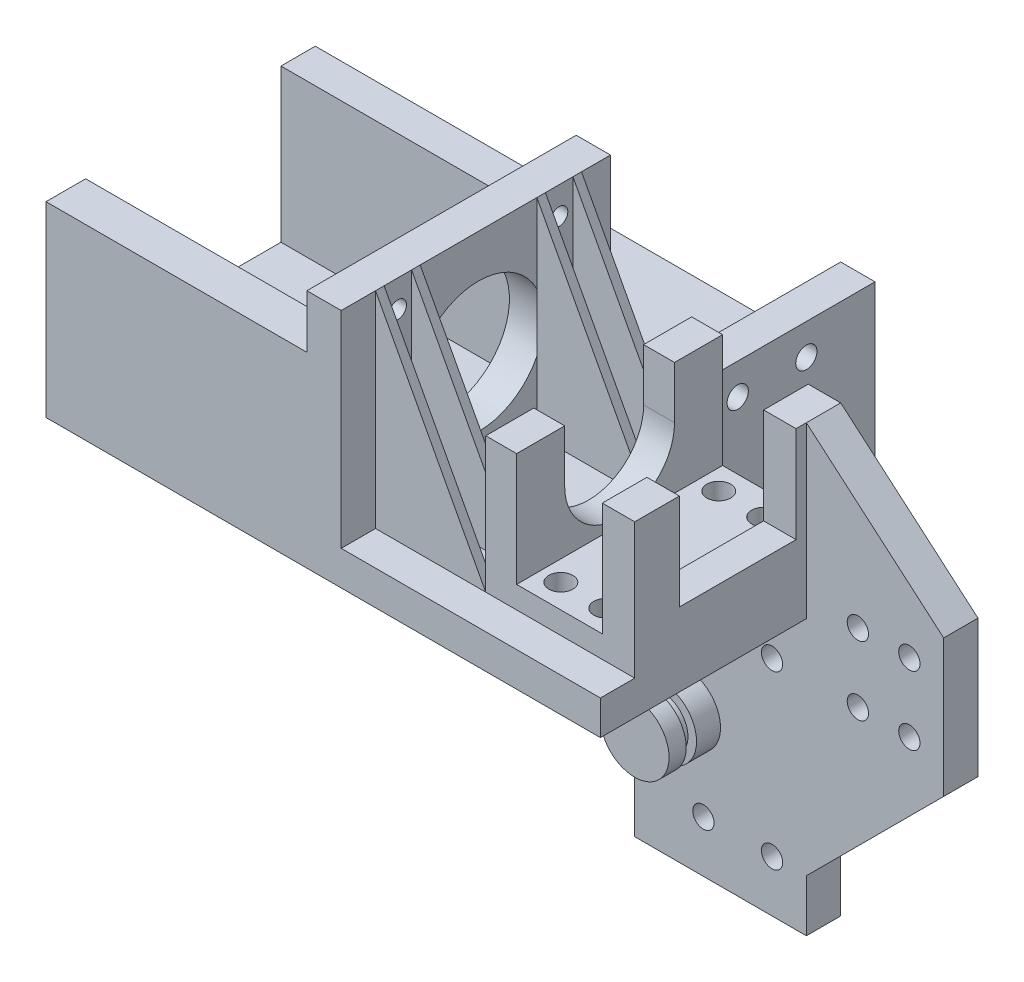
from build123d import *

# Parameters (mm, degrees)
BOSS_EXTRUDE1_DEPTH  = 10
SKETCH2_W            = 9.45
SKETCH2_H            = 60
BOSS_EXTRUDE2_DEPTH  = 39.45
SKETCH3_W            = 24.96
SKETCH3_H            = 60
BOSS_EXTRUDE3_DEPTH  = 6.45
SKETCH4_W            = 9
SKETCH4_H            = 60
BOSS_EXTRUDE4_DEPTH  = 39.45
CUT_EXTRUDE1_REACH   = 209.197
SKETCH5_W            = 34
SKETCH5_H            = 28
CUT_EXTRUDE2_REACH   = 183.658
SKETCH7_W            = 76
SKETCH7_H            = 11.55
BOSS_EXTRUDE5_DEPTH  = 44.46
SKETCH8_W            = 76
SKETCH8_H            = 10
BOSS_EXTRUDE6_DEPTH  = 44.46
SKETCH9_W            = 10
SKETCH9_H            = 78.45
BOSS_EXTRUDE7_DEPTH  = 60
SKETCH10_W           = 2.5
SKETCH10_H           = 60
BOSS_EXTRUDE8_DEPTH  = 32.1
BOSS_EXTRUDE12_DEPTH = 10
CUT_EXTRUDE5_DEPTH   = 228.829497871
SKETCH17_W           = 10
SKETCH17_H           = 50
BOSS_EXTRUDE13_DEPTH = 80
SKETCH18_W           = 10
SKETCH18_H           = 50
BOSS_EXTRUDE14_DEPTH = 25
SKETCH19_R           = 3.5
CUT_EXTRUDE6_DEPTH   = 20
SKETCH20_W           = 27
SKETCH20_H           = 6
CUT_EXTRUDE7_DEPTH   = 10
SKETCH21_R           = 2.51
SKETCH21_R_2         = 19
CUT_EXTRUDE8_DEPTH   = 10
SKETCH22_R           = 3.1
CUT_EXTRUDE9_DEPTH   = 10
SKETCH23_R           = 3.1
CUT_EXTRUDE10_DEPTH  = 10
SKETCH24_R           = 10
BOSS_EXTRUDE15_DEPTH = 15
CUT_EXTRUDE11_START  = -8
SKETCH25_R           = 10
SKETCH25_R_2         = 7.5
CUT_EXTRUDE11_DEPTH  = 3
SKETCH26_R           = 10
BOSS_EXTRUDE16_DEPTH = 15
CUT_EXTRUDE12_START  = -8
SKETCH27_R           = 10
SKETCH27_R_2         = 7.5
CUT_EXTRUDE12_DEPTH  = 3


with BuildPart() as part:
    # Sketch1 → Boss-Extrude1 (new body)
    with BuildSketch(Plane(origin=(0, 0, 0), x_dir=(1, 0, 0), z_dir=(0, 1, 0))):
        Polygon((0, 0), (161.51, 0), (161.51, 70), (121.51, 70), (121.51, 120), (0, 120), align=None)
    extrude(amount=BOSS_EXTRUDE1_DEPTH)

    # Sketch2 → Boss-Extrude2 (add)
    with BuildSketch(Plane(origin=(0, 10, 0), x_dir=(1, 0, 0), z_dir=(0, 1, 0))):
        with Locations((156.785, 40)):
            Rectangle(SKETCH2_W, SKETCH2_H)
    extrude(amount=BOSS_EXTRUDE2_DEPTH)

    # Sketch3 → Boss-Extrude3 (add)
    with BuildSketch(Plane(origin=(0, 10, 0), x_dir=(1, 0, 0), z_dir=(0, 1, 0))):
        with Locations((139.58, 40)):
            Rectangle(SKETCH3_W, SKETCH3_H)
    extrude(amount=BOSS_EXTRUDE3_DEPTH)

    # Sketch4 → Boss-Extrude4 (add)
    with BuildSketch(Plane(origin=(0, 10, 0), x_dir=(1, 0, 0), z_dir=(0, 1, 0))):
        with Locations((122.6, 40)):
            Rectangle(SKETCH4_W, SKETCH4_H)
    extrude(amount=BOSS_EXTRUDE4_DEPTH)

    # Sketch5 → Cut-Extrude1 (cut, up to next)
    with BuildSketch(Plane(origin=(161.51, 0, 0), x_dir=(0, 0, -1), z_dir=(1, 0, 0)), mode=Mode.PRIVATE) as cut_extrude1_sk1:
        with Locations((40, 35.45)):
            Rectangle(SKETCH5_W, SKETCH5_H)
    cut_extrude1_tool1 = extrude(cut_extrude1_sk1.sketch, amount=-CUT_EXTRUDE1_REACH, mode=Mode.PRIVATE) & part.part
    add(cut_extrude1_tool1.solids().sort_by_distance((161.51, 35.45, -40))[0], mode=Mode.SUBTRACT)

    # Sketch6 → Cut-Extrude2 (cut, up to next)
    with BuildSketch(Plane(origin=(127.1, 0, 0), x_dir=(0, 0, -1), z_dir=(1, 0, 0)), mode=Mode.PRIVATE) as cut_extrude2_sk1:
        with BuildLine():
            Line((24, 49.45), (24, 34.24))
            ThreePointArc((24, 34.24), (40, 18.24), (56, 34.24))
            Line((56, 34.24), (56, 49.45))
            Line((56, 49.45), (24, 49.45))
        make_face()
    cut_extrude2_tool1 = extrude(cut_extrude2_sk1.sketch, amount=-CUT_EXTRUDE2_REACH, mode=Mode.PRIVATE) & part.part
    add(cut_extrude2_tool1.solids().sort_by_distance((127.1, 35.332249, -40))[0], mode=Mode.SUBTRACT)

    # Sketch7 → Boss-Extrude5 (add)
    with BuildSketch(Plane(origin=(0, 10, 0), x_dir=(1, 0, 0), z_dir=(0, 1, 0))):
        with Locations((38, 5.775)):
            Rectangle(SKETCH7_W, SKETCH7_H)
    extrude(amount=BOSS_EXTRUDE5_DEPTH)

    # Sketch8 → Boss-Extrude6 (add)
    with BuildSketch(Plane(origin=(0, 10, 0), x_dir=(1, 0, 0), z_dir=(0, 1, 0))):
        with Locations((38, 73.45)):
            Rectangle(SKETCH8_W, SKETCH8_H)
    extrude(amount=BOSS_EXTRUDE6_DEPTH)

    # Sketch9 → Boss-Extrude7 (add)
    with BuildSketch(Plane(origin=(0, 10, 0), x_dir=(1, 0, 0), z_dir=(0, 1, 0))):
        with Locations((81, 39.225)):
            Rectangle(SKETCH9_W, SKETCH9_H)
    extrude(amount=BOSS_EXTRUDE7_DEPTH)

    # Sketch10 → Boss-Extrude8 (add)
    with BuildSketch(Plane(origin=(86, 0, 0), x_dir=(0, 0, -1), z_dir=(1, 0, 0))):
        with Locations((68.75, 40)):
            Rectangle(SKETCH10_W, SKETCH10_H)
        with Locations((58.25, 40)):
            Rectangle(SKETCH10_W, SKETCH10_H)
        with Locations((21.75, 40)):
            Rectangle(SKETCH10_W, SKETCH10_H)
        with Locations((11.25, 40)):
            Rectangle(SKETCH10_W, SKETCH10_H)
    extrude(amount=BOSS_EXTRUDE8_DEPTH)

    # Sketch13 → Boss-Extrude12 (add)
    with BuildSketch(Plane(origin=(0, 0, -70), x_dir=(-1, 0, 0), z_dir=(0, 0, -1))):
        Polygon((-111.51, 0), (-161.51, 0), (-161.51, 49.45), (-201.51, 15.153701366), (-201.51, -24.846298634), (-161.51, -64.85), (-161.51, -80), (-111.51, -80), align=None)
    extrude(amount=-BOSS_EXTRUDE12_DEPTH)

    # Sketch16 → Cut-Extrude5 (cut, through all)
    with BuildSketch(Plane(origin=(0, 0, -70), x_dir=(-1, 0, 0), z_dir=(0, 0, -1))):
        Polygon((-86, 70), (-118.1, 70), (-118.1, 10), align=None)
    extrude(amount=-CUT_EXTRUDE5_DEPTH, mode=Mode.SUBTRACT)

    # Sketch17 → Boss-Extrude13 (add)
    with BuildSketch(Plane.XZ):
        with Locations((116.51, -95)):
            Rectangle(SKETCH17_W, SKETCH17_H)
    extrude(amount=BOSS_EXTRUDE13_DEPTH)

    # Sketch18 → Boss-Extrude14 (add)
    with BuildSketch(Plane(origin=(0, 10, 0), x_dir=(1, 0, 0), z_dir=(0, 1, 0))):
        with Locations((116.51, 95)):
            Rectangle(SKETCH18_W, SKETCH18_H)
    extrude(amount=BOSS_EXTRUDE14_DEPTH)

    # Sketch19 → Cut-Extrude6 (cut)
    with BuildSketch(Plane(origin=(0, 16.45, 0), x_dir=(1, 0, 0), z_dir=(0, 1, 0))):
        with Locations(Location((146.1, 62.98, 0), (0, 0, 270))):
            Circle(SKETCH19_R)
        with Locations(Location((133, 62.98, 0), (0, 0, 270))):
            Circle(SKETCH19_R)
        with Locations(Location((133, 16.98, 0), (0, 0, 270))):
            Circle(SKETCH19_R)
        with Locations(Location((146.1, 16.98, 0), (0, 0, 270))):
            Circle(SKETCH19_R)
    extrude(amount=-CUT_EXTRUDE6_DEPTH, mode=Mode.SUBTRACT)

    # Sketch20 → Cut-Extrude7 (cut)
    with BuildSketch(Plane.XY.offset(-60)):
        with Locations((139.6, -3)):
            Rectangle(SKETCH20_W, SKETCH20_H)
    extrude(amount=-CUT_EXTRUDE7_DEPTH, mode=Mode.SUBTRACT)

    # Sketch21 → Cut-Extrude8 (cut)
    with BuildSketch(Plane.ZY.offset(-76)):
        with Locations((-16.5, 61.95)):
            Circle(SKETCH21_R)
        with Locations((-63.5, 61.95)):
            Circle(SKETCH21_R)
        with Locations((-63.5, 14.95)):
            Circle(SKETCH21_R)
        with Locations((-16.5, 14.95)):
            Circle(SKETCH21_R)
        with Locations((-40, 38.45)):
            Circle(SKETCH21_R_2)
    extrude(amount=-CUT_EXTRUDE8_DEPTH, mode=Mode.SUBTRACT)

    # Sketch22 → Cut-Extrude9 (cut)
    with BuildSketch(Plane(origin=(0, 0, -70), x_dir=(-1, 0, 0), z_dir=(0, 0, -1))):
        with Locations((-131.51, -15)):
            Circle(SKETCH22_R)
        with Locations((-151.51, -15)):
            Circle(SKETCH22_R)
        with Locations((-151.51, -65)):
            Circle(SKETCH22_R)
        with Locations((-131.51, -65)):
            Circle(SKETCH22_R)
        with Locations((-191.51, 5.153701366)):
            Circle(SKETCH22_R)
        with Locations((-176.51, 5.153701366)):
            Circle(SKETCH22_R)
        with Locations((-176.51, -14.846298634)):
            Circle(SKETCH22_R)
        with Locations((-191.51, -14.846298634)):
            Circle(SKETCH22_R)
    extrude(amount=-CUT_EXTRUDE9_DEPTH, mode=Mode.SUBTRACT)

    # Sketch23 → Cut-Extrude10 (cut)
    with BuildSketch(Plane.ZY.offset(-111.51)):
        with Locations((-100, 25.93)):
            Circle(SKETCH23_R)
        with Locations((-80, 25.93)):
            Circle(SKETCH23_R)
        with Locations((-80, -15.01)):
            Circle(SKETCH23_R)
        with Locations((-100, -15.01)):
            Circle(SKETCH23_R)
        with Locations((-100, -65.01)):
            Circle(SKETCH23_R)
        with Locations((-80, -65.01)):
            Circle(SKETCH23_R)
    extrude(amount=-CUT_EXTRUDE10_DEPTH, mode=Mode.SUBTRACT)

    # Sketch24 → Boss-Extrude15 (add)
    with BuildSketch(Plane.XY.offset(-60)):
        with Locations(Location((126.51, -40, 0), (0, 0, 180))):
            Circle(SKETCH24_R)
    extrude(amount=BOSS_EXTRUDE15_DEPTH)

    # Sketch25 → Cut-Extrude11 (cut)
    with BuildSketch(Plane.XY.offset(-45).offset(CUT_EXTRUDE11_START)):
        with Locations(Location((126.51, -40, 0), (0, 0, 180))):
            Circle(SKETCH25_R)
        with Locations((126.51, -40)):
            Circle(SKETCH25_R_2, mode=Mode.SUBTRACT)
    extrude(amount=CUT_EXTRUDE11_DEPTH, mode=Mode.SUBTRACT)

    # Sketch26 → Boss-Extrude16 (add)
    with BuildSketch(Plane.ZY.offset(-111.51)):
        with Locations((-75, -40)):
            Circle(SKETCH26_R)
    extrude(amount=BOSS_EXTRUDE16_DEPTH)

    # Sketch27 → Cut-Extrude12 (cut)
    with BuildSketch(Plane.ZY.offset(-96.51).offset(CUT_EXTRUDE12_START)):
        with Locations((-75, -40)):
            Circle(SKETCH27_R)
        with Locations((-75, -40)):
            Circle(SKETCH27_R_2, mode=Mode.SUBTRACT)
    extrude(amount=CUT_EXTRUDE12_DEPTH, mode=Mode.SUBTRACT)


solid = part.part
